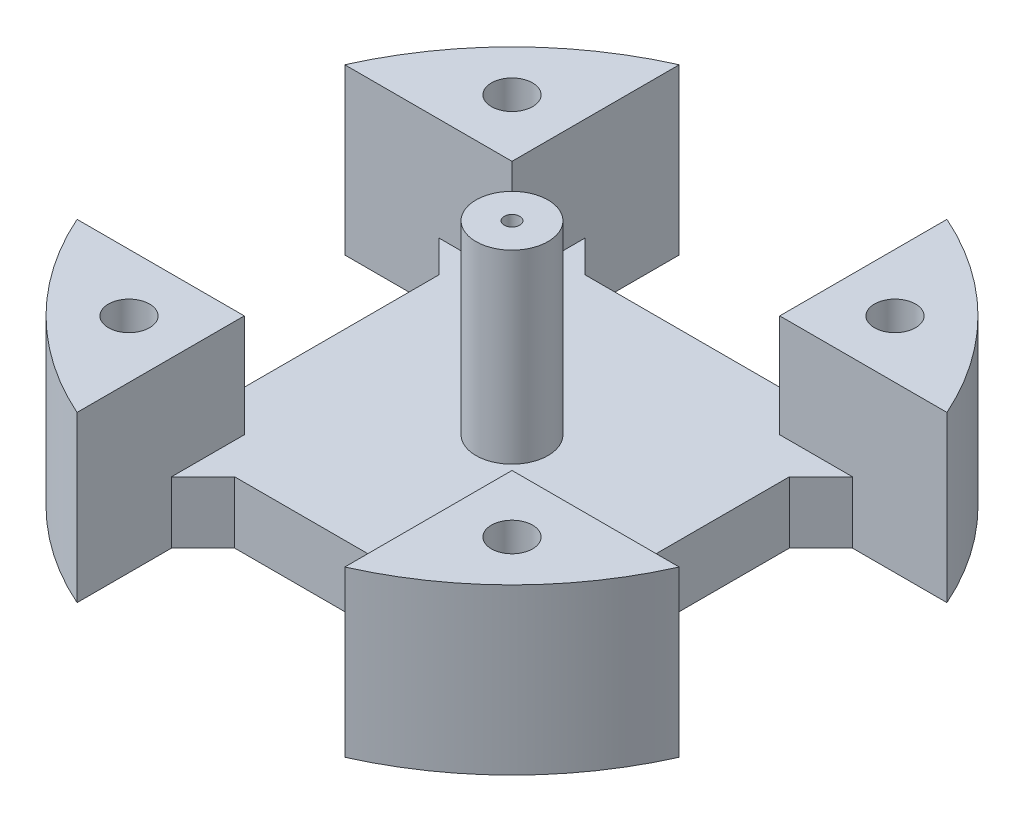
from build123d import *

# Parameters (mm, degrees)
CROQUIS1_R                 = 16
SALIENTE_EXTRUIR1_DEPTH    = 8
CORTAR_EXTRUIR2_DEPTH      = 10
CORTAR_EXTRUIR4_DEPTH      = 5
CORTAR_EXTRUIR4_DEPTH_BACK = 10
CORTAR_EXTRUIR4_START      = -8
CROQUIS5_R                 = 1.75
SALIENTE_EXTRUIR2_DEPTH    = 9
CROQUIS6_6_R               = 1
CORTAR_EXTRUIR8_DEPTH      = 10
CROQUIS10_3_R              = 6.75
CORTAR_EXTRUIR10_DEPTH     = 2
CROQUIS13_R                = 0.375
CORTAR_EXTRUIR11_DEPTH     = 22


with BuildPart() as part:
    # Croquis1 → Saliente-Extruir1 (new body)
    with BuildSketch(Plane(origin=(0, 0, 0), x_dir=(1, 0, 0), z_dir=(0, 1, 0))):
        with Locations(Location((0, 0, 0), (0, 0, 270))):
            Circle(CROQUIS1_R)
    extrude(amount=SALIENTE_EXTRUIR1_DEPTH)

    # Croquis2 → Cortar-Extruir2 (cut)
    with BuildSketch(Plane(origin=(0, 0, 0), x_dir=(-1, 0, 0), z_dir=(0, -1, 0))):
        with BuildLine():
            ThreePointArc((-6.5, -14.620191518), (0, -16), (6.5, -14.620191517))
            Line((6.5, -14.620191517), (6.5, -10.035533906))
            Line((6.5, -10.035533906), (4.964466094, -8.5))
            Line((4.964466094, -8.5), (-4.964466094, -8.5))
            Line((-4.964466094, -8.5), (-6.5, -10.035533906))
            Line((-6.5, -10.035533906), (-6.5, -14.620191517))
        make_face()
        with BuildLine():
            Line((-4.964466094, 8.5), (4.964466094, 8.5))
            Line((4.964466094, 8.5), (6.5, 10.035533906))
            Line((6.5, 10.035533906), (6.5, 14.620191517))
            ThreePointArc((6.5, 14.620191518), (0, 16.000000001), (-6.5, 14.620191518))
            Line((-6.5, 14.620191517), (-6.5, 10.035533906))
            Line((-6.5, 10.035533906), (-4.964466094, 8.5))
        make_face()
        with BuildLine():
            Line((10.035533906, -6.5), (14.620191517, -6.5))
            ThreePointArc((14.620191515, -6.499999999), (15.651246979, -3.322418977), (15.999999994, 0))
            ThreePointArc((16, 0), (15.651246984, 3.322418978), (14.620191517, 6.5))
            Line((14.620191517, 6.5), (10.035533906, 6.5))
            Line((10.035533906, 6.5), (8.5, 4.964466094))
            Line((8.5, 4.964466094), (8.5, -4.964466094))
            Line((8.5, -4.964466094), (10.035533906, -6.5))
        make_face()
        with BuildLine():
            ThreePointArc((-14.620191518, 6.5), (-16.000000001, 0), (-14.620191518, -6.5))
            Line((-14.620191517, -6.5), (-10.035533906, -6.5))
            Line((-10.035533906, -6.5), (-8.5, -4.964466094))
            Line((-8.5, -4.964466094), (-8.5, 4.964466094))
            Line((-8.5, 4.964466094), (-10.035533906, 6.5))
            Line((-10.035533906, 6.5), (-14.620191517, 6.5))
        make_face()
    extrude(amount=-CORTAR_EXTRUIR2_DEPTH, mode=Mode.SUBTRACT)

    # Croquis4 → Cortar-Extruir4 (cut, two sides: drawn at the far end of the back side and taken through both)
    with BuildSketch(Plane.XZ.offset(CORTAR_EXTRUIR4_START - CORTAR_EXTRUIR4_DEPTH_BACK)):
        Polygon((-6.5, 16.599431938), (-6.5, 6.5), (-19.32076002, 6.5), (-19.32076002, -6.5), (-6.5, -6.5), (-6.5, -17.296221808), (6.5, -17.296221808), (6.5, -6.5), (20.964302933, -6.5), (20.964302933, 6.5), (6.5, 6.5), (6.5, 16.599431938), align=None)
    extrude(amount=CORTAR_EXTRUIR4_DEPTH + CORTAR_EXTRUIR4_DEPTH_BACK, mode=Mode.SUBTRACT)

    # Croquis5 → Saliente-Extruir2 (add)
    with BuildSketch(Plane(origin=(0, 3, 0), x_dir=(1, 0, 0), z_dir=(0, 1, 0))):
        with Locations(Location((0, 0, 0), (0, 0, 270))):
            Circle(CROQUIS5_R)
    extrude(amount=SALIENTE_EXTRUIR2_DEPTH)

    # Croquis6<6> → Cortar-Extruir8 (cut)
    with BuildSketch(Plane(origin=(0, 8, 0), x_dir=(1, 0, 0), z_dir=(0, 1, 0))):
        with Locations(Location((-9.298454173, 9.298454173, 0), (0, 0, 270))):
            Circle(CROQUIS6_6_R)
        with Locations(Location((9.298454173, 9.298454173, 0), (0, 0, 270))):
            Circle(CROQUIS6_6_R)
        with Locations(Location((9.298454173, -9.298454173, 0), (0, 0, 270))):
            Circle(CROQUIS6_6_R)
        with Locations(Location((-9.298454173, -9.298454173, 0), (0, 0, 270))):
            Circle(CROQUIS6_6_R)
    extrude(amount=-CORTAR_EXTRUIR8_DEPTH, mode=Mode.SUBTRACT)

    # Croquis10<3> → Cortar-Extruir10 (cut)
    with BuildSketch(Plane.XZ):
        with Locations(Location((0, 0, 0), (0, 0, 270))):
            Circle(CROQUIS10_3_R)
    extrude(amount=-CORTAR_EXTRUIR10_DEPTH, mode=Mode.SUBTRACT)

    # Croquis13 → Cortar-Extruir11 (cut)
    with BuildSketch(Plane.XZ):
        with Locations(Location((0, 0, 0), (0, 0, 270))):
            Circle(CROQUIS13_R)
    extrude(amount=-CORTAR_EXTRUIR11_DEPTH, mode=Mode.SUBTRACT)


solid = part.part
